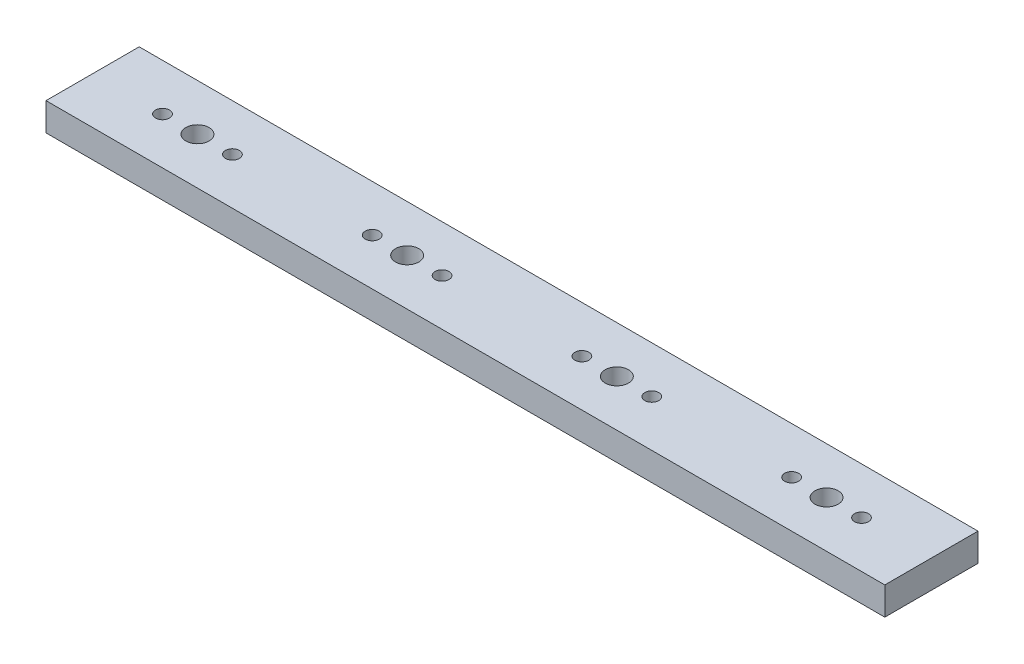
from build123d import *

# Parameters (mm, degrees)
SKETCH1_W           = 360
SKETCH1_H           = 40
BOSS_EXTRUDE1_DEPTH = 12
CUT_EXTRUDE1_REACH  = 183.505
SKETCH2_R           = 3
SKETCH2_R_2         = 5
LPATTERN1_COUNT     = 4
LPATTERN1_PITCH     = 90


with BuildPart() as part:
    # Sketch1 → Boss-Extrude1 (new body)
    with BuildSketch(Plane(origin=(0, 0, 0), x_dir=(1, 0, 0), z_dir=(0, 1, 0))):
        Rectangle(SKETCH1_W, SKETCH1_H)
    extrude(amount=BOSS_EXTRUDE1_DEPTH)

    # Sketch2 → Cut-Extrude1 (cut, up to next)
    with BuildSketch(Plane(origin=(0, 12, 0), x_dir=(1, 0, 0), z_dir=(0, 1, 0)), mode=Mode.PRIVATE) as cut_extrude1_sk1:
        with Locations(Location((-150, 0, 0), (0, 0, 270))):
            Circle(SKETCH2_R)
    cut_extrude1_tool1 = extrude(cut_extrude1_sk1.sketch, amount=-CUT_EXTRUDE1_REACH, mode=Mode.PRIVATE) & part.part
    # Sketch2 → Cut-Extrude1 (cut, up to next)
    with BuildSketch(Plane(origin=(0, 12, 0), x_dir=(1, 0, 0), z_dir=(0, 1, 0)), mode=Mode.PRIVATE) as cut_extrude1_sk2:
        with Locations(Location((-120, 0, 0), (0, 0, 270))):
            Circle(SKETCH2_R)
    cut_extrude1_tool2 = extrude(cut_extrude1_sk2.sketch, amount=-CUT_EXTRUDE1_REACH, mode=Mode.PRIVATE) & part.part
    # Sketch2 → Cut-Extrude1 (cut, up to next)
    with BuildSketch(Plane(origin=(0, 12, 0), x_dir=(1, 0, 0), z_dir=(0, 1, 0)), mode=Mode.PRIVATE) as cut_extrude1_sk3:
        with Locations(Location((-135, 0, 0), (0, 0, 270))):
            Circle(SKETCH2_R_2)
    cut_extrude1_tool3 = extrude(cut_extrude1_sk3.sketch, amount=-CUT_EXTRUDE1_REACH, mode=Mode.PRIVATE) & part.part
    cut_extrude1_1 = cut_extrude1_tool1.solids().sort_by_distance((-150, 12, 0))[0]
    add(cut_extrude1_1, mode=Mode.SUBTRACT)
    cut_extrude1_2 = cut_extrude1_tool2.solids().sort_by_distance((-120, 12, 0))[0]
    add(cut_extrude1_2, mode=Mode.SUBTRACT)
    cut_extrude1_3 = cut_extrude1_tool3.solids().sort_by_distance((-135, 12, 0))[0]
    add(cut_extrude1_3, mode=Mode.SUBTRACT)
    cut_extrude1 = cut_extrude1_1 + cut_extrude1_2 + cut_extrude1_3  # Cut-Extrude1 as one shape, for the pattern or mirror that repeats it

    # LPattern1: Cut-Extrude1 ×4
    with Locations(*[(i * LPATTERN1_PITCH, 0, 0) for i in range(1, LPATTERN1_COUNT)]):
        add(cut_extrude1, mode=Mode.SUBTRACT)


solid = part.part
